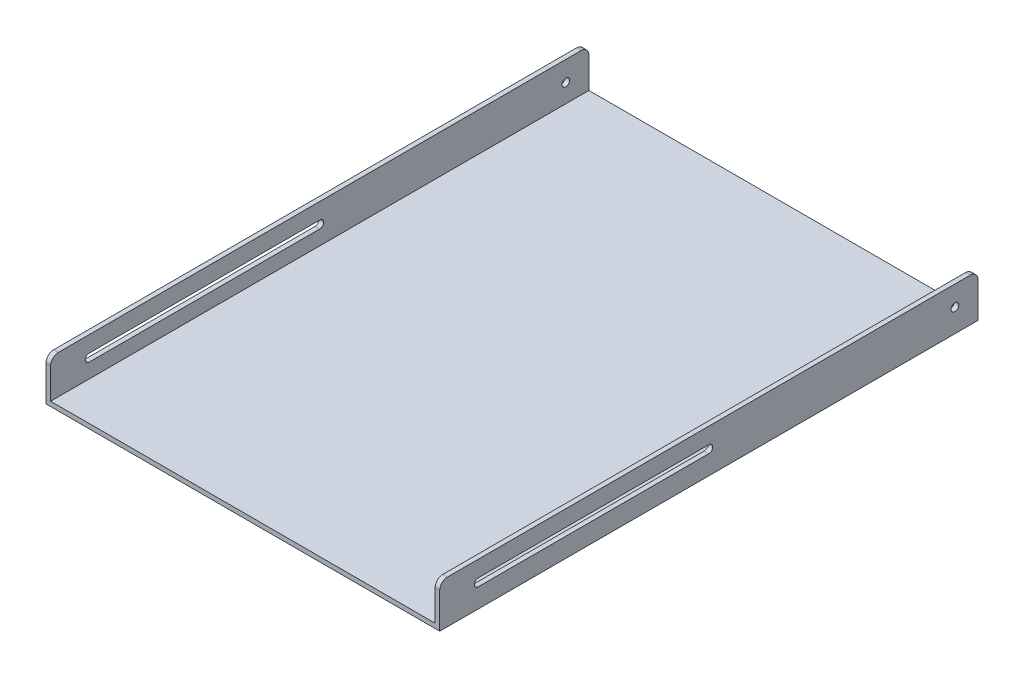
from build123d import *

# Parameters (mm, degrees)
EXTRUDE_THIN1_DEPTH = 350
SKETCH2_R           = 5
CUT_EXTRUDE1_DEPTH  = 623.208968113
FILLET1_R           = 10


with BuildPart() as part:
    # Sketch1 → Extrude-Thin1 (new, symmetric)
    with BuildSketch(Plane.XY):
        Polygon((-250, 50), (-250, 0), (250, 0), (250, 50), (256, 50), (256, -6), (-256, -6), (-256, 50), align=None)
    extrude(amount=EXTRUDE_THIN1_DEPTH, both=True)

    # Sketch2 → Cut-Extrude1 (cut, through all)
    with BuildSketch(Plane(origin=(256, 0, 0), x_dir=(0, 0, -1), z_dir=(1, 0, 0))):
        with Locations((320, 24)):
            Circle(SKETCH2_R)
        with BuildLine():
            Line((-300, 29), (0, 29))
            ThreePointArc((0, 29), (5, 24), (0, 19))
            Line((0, 19), (-300, 19))
            ThreePointArc((-300, 19), (-305, 24), (-300, 29))
        make_face()
    extrude(amount=-CUT_EXTRUDE1_DEPTH, mode=Mode.SUBTRACT)

    # Fillet1
    fillet1_edges = [part.edges().sort_by_distance(p)[0] for p in [
        (-253, 50, 350),
        (253, 50, 350),
        (-253, 50, -350),
        (253, 50, -350),
    ]]
    fillet(fillet1_edges, radius=FILLET1_R)


solid = part.part
